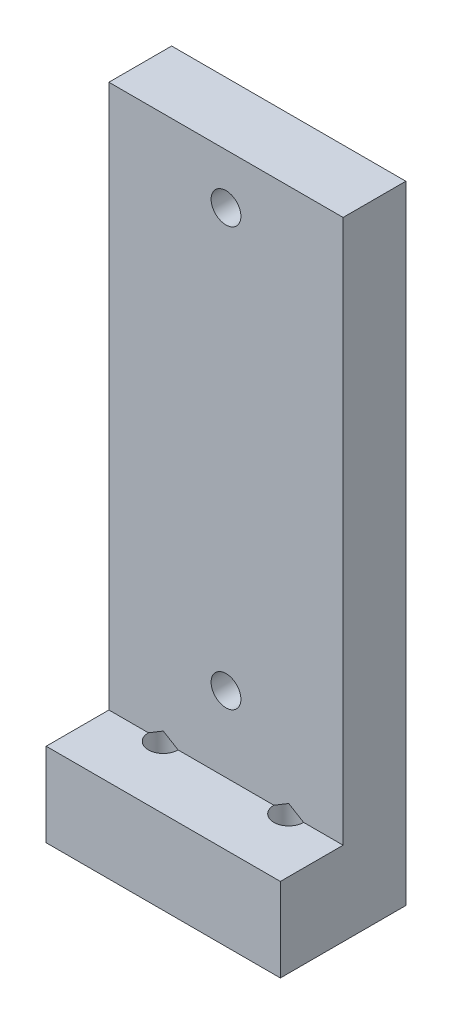
from build123d import *

# Parameters (mm, degrees)
SKETCH1_W                 = 17.78
SKETCH1_H                 = 9.525
BOSS_EXTRUDE1_DEPTH       = 47.625
SKETCH2_W                 = 17.78
SKETCH2_H                 = 4.7625
CUT_EXTRUDE1_DEPTH        = 41.275
F_4_40_TAPPED_HOLE1_D     = 2.2606
F_4_40_TAPPED_HOLE1_DEPTH = 6.35
F_4_40_TAPPED_HOLE1_TIP   = 0.679152758
SKETCH8_R                 = 1.1303
CUT_EXTRUDE2_DEPTH        = 50.375078228


with BuildPart() as part:
    # Sketch1 → Boss-Extrude1 (new body)
    with BuildSketch(Plane(origin=(0, 0, 0), x_dir=(1, 0, 0), z_dir=(0, 1, 0))):
        Rectangle(SKETCH1_W, SKETCH1_H)
    extrude(amount=BOSS_EXTRUDE1_DEPTH)

    # Sketch2 → Cut-Extrude1 (cut)
    with BuildSketch(Plane(origin=(0, 47.625, 0), x_dir=(1, 0, 0), z_dir=(0, 1, 0))):
        with Locations((0, -2.38125)):
            Rectangle(SKETCH2_W, SKETCH2_H)
    extrude(amount=-CUT_EXTRUDE1_DEPTH, mode=Mode.SUBTRACT)

    # #4-40 Tapped Hole1
    with Locations(Plane(origin=(0, 0, 0), x_dir=(-1, 0, 0), z_dir=(0, -1, 0))):
        with Locations((-4.7625, 0), (4.7625, 0)):
            Hole(F_4_40_TAPPED_HOLE1_D / 2, depth=F_4_40_TAPPED_HOLE1_DEPTH)
            with Locations((0, 0, -(F_4_40_TAPPED_HOLE1_DEPTH + F_4_40_TAPPED_HOLE1_TIP / 2))):  # 118° drill point
                Cone(0, F_4_40_TAPPED_HOLE1_D / 2, F_4_40_TAPPED_HOLE1_TIP, mode=Mode.SUBTRACT)

    # Sketch8 → Cut-Extrude2 (cut, through all)
    with BuildSketch(Plane(origin=(0, 0, -4.7625), x_dir=(-1, 0, 0), z_dir=(0, 0, -1))):
        with Locations((0, 43.815)):
            Circle(SKETCH8_R)
        with Locations((0, 12.065)):
            Circle(SKETCH8_R)
    extrude(amount=-CUT_EXTRUDE2_DEPTH, mode=Mode.SUBTRACT)


solid = part.part
